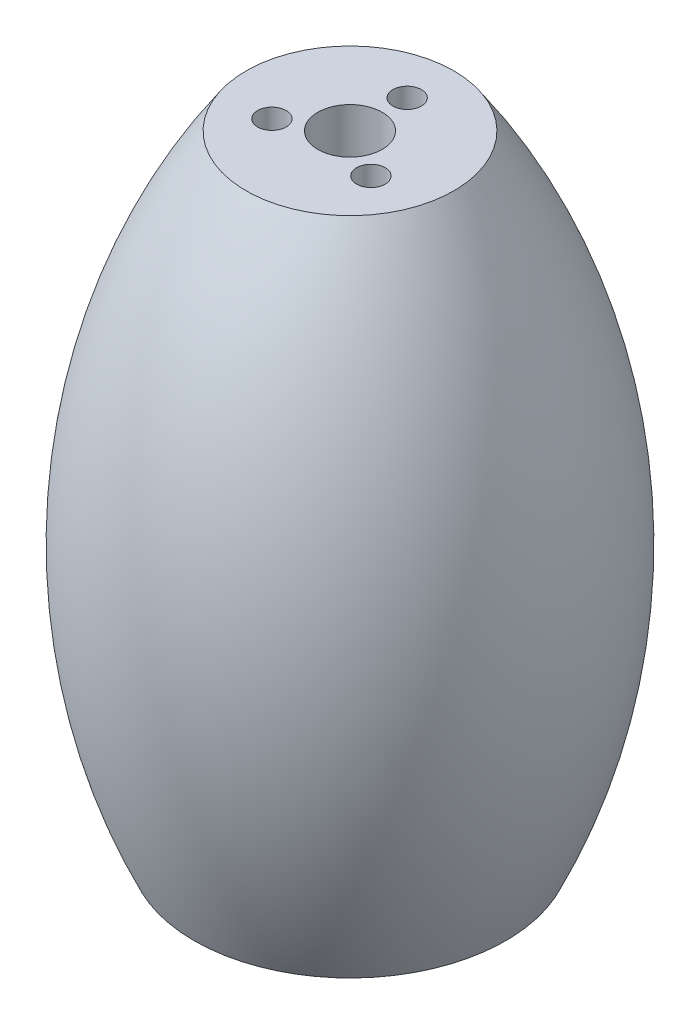
from build123d import *

# Parameters (mm, degrees)
SKETCH_2_R          = 2.75
CUT_EXTRUDE_1_DEPTH = 5
SKETCH_3_R          = 6.2
CUT_EXTRUDE_2_DEPTH = 134.492132213


with BuildPart() as part:
    # ｽｹｯﾁ1 → 回転1 (revolve)
    with BuildSketch(Plane.XY, mode=Mode.PRIVATE) as revolve_1_sk:
        with BuildLine():
            Line((-30, 0), (0, 0))
            Line((0, 0), (0, 120))
            Line((0, 120), (-20, 120))
            ThreePointArc((-20, 120), (-40.933866224, 61.327822185), (-30, 0))
        make_face()
    revolve(revolve_1_sk.sketch.rotate(Axis((0, 0, 0), (0, 1, 0)), 270), axis=Axis((0, 0, 0), (0, 1, 0)))

    # ｽｹｯﾁ2 → ｶｯﾄ - 押し出し1 (cut)
    with BuildSketch(Plane(origin=(0, 120, 0), x_dir=(1, 0, 0), z_dir=(0, 1, 0))):
        with Locations(Location((0, 11, 0), (0, 0, 270))):
            Circle(SKETCH_2_R)
        with Locations(Location((9.526279442, -5.5, 0), (0, 0, 270))):
            Circle(SKETCH_2_R)
        with Locations(Location((-9.526279442, -5.5, 0), (0, 0, 270))):
            Circle(SKETCH_2_R)
    cut_extrude_1 = extrude(amount=-CUT_EXTRUDE_1_DEPTH, mode=Mode.SUBTRACT)

    # ﾐﾗｰ1: ｶｯﾄ - 押し出し1 across plane
    add(cut_extrude_1.mirror(Plane.ZX.offset(60)), mode=Mode.SUBTRACT)

    # ｽｹｯﾁ3 → ｶｯﾄ - 押し出し2 (cut, through all)
    with BuildSketch(Plane(origin=(0, 120, 0), x_dir=(1, 0, 0), z_dir=(0, 1, 0))):
        with Locations(Location((0, 0, 0), (0, 0, 270))):
            Circle(SKETCH_3_R)
    extrude(amount=-CUT_EXTRUDE_2_DEPTH, mode=Mode.SUBTRACT)


solid = part.part
